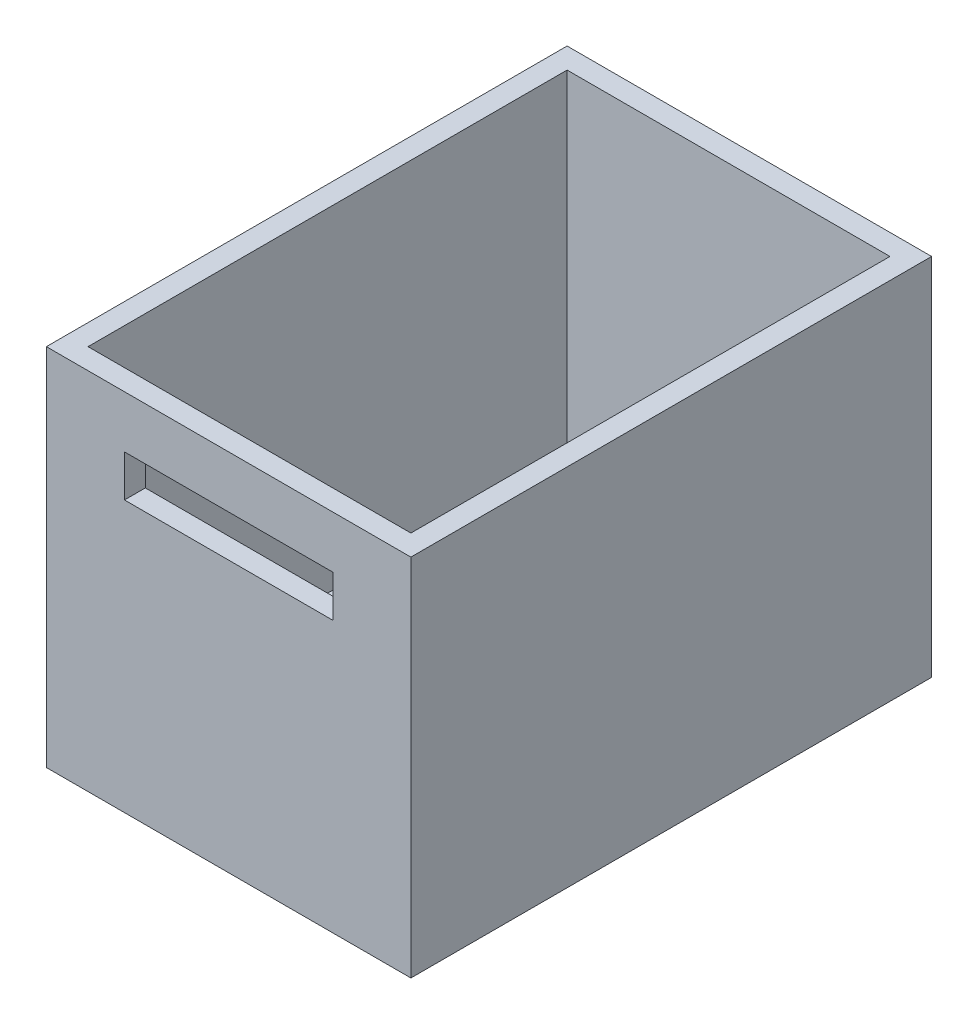
from build123d import *

# Parameters (mm, degrees)
SKETCH1_W           = 175
SKETCH1_H           = 250
BOSS_EXTRUDE1_DEPTH = 175
SKETCH2_W           = 155
SKETCH2_H           = 230
CUT_EXTRUDE1_DEPTH  = 160
SKETCH3_W           = 100
SKETCH3_H           = 20
CUT_EXTRUDE2_DEPTH  = 100


with BuildPart() as part:
    # Sketch1 → Boss-Extrude1 (new body)
    with BuildSketch(Plane(origin=(0, 0, 0), x_dir=(1, 0, 0), z_dir=(0, 1, 0))):
        Rectangle(SKETCH1_W, SKETCH1_H)
    extrude(amount=BOSS_EXTRUDE1_DEPTH)

    # Sketch2 → Cut-Extrude1 (cut)
    with BuildSketch(Plane(origin=(0, 175, 0), x_dir=(1, 0, 0), z_dir=(0, 1, 0))):
        Rectangle(SKETCH2_W, SKETCH2_H)
    extrude(amount=-CUT_EXTRUDE1_DEPTH, mode=Mode.SUBTRACT)

    # Sketch3 → Cut-Extrude2 (cut)
    with BuildSketch(Plane.XY.offset(125)):
        with Locations((0, 140)):
            Rectangle(SKETCH3_W, SKETCH3_H)
    extrude(amount=-CUT_EXTRUDE2_DEPTH, mode=Mode.SUBTRACT)


solid = part.part
